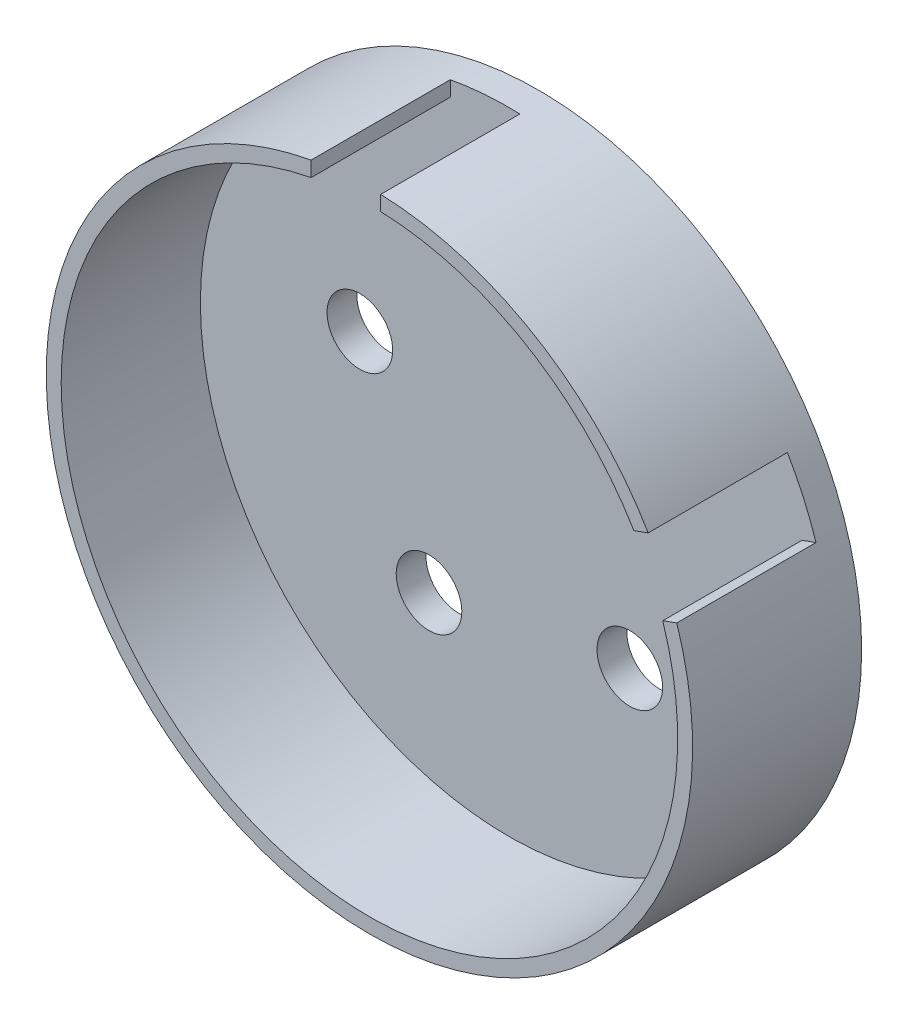
from build123d import *

# Parameters (mm, degrees)
ESQUISSE1_R                  = 32.5
BOSS_EXTRU_1_DEPTH           = 17
ESQUISSE2_R                  = 31
ENL_V_MAT_EXTRU_1_DEPTH      = 14
ESQUISSE3_W                  = 7
ESQUISSE3_H                  = 21.006684507
ENL_V_MAT_EXTRU_2_DEPTH      = 14
R_P_TITION_CIRCULAIRE1_COUNT = 2
R_P_TITION_CIRCULAIRE1_ANGLE = 70
D_GAGEMENT_M61_D             = 6.6
R_P_TITION_CIRCULAIRE2_COUNT = 3
R_P_TITION_CIRCULAIRE2_ANGLE = 160


with BuildPart() as part:
    # Esquisse1 → Boss.-Extru.1 (new body)
    with BuildSketch(Plane.XY):
        Circle(ESQUISSE1_R)
    extrude(amount=BOSS_EXTRU_1_DEPTH)

    # Esquisse2 → Enlèv. mat.-Extru.1 (cut)
    with BuildSketch(Plane.XY.offset(17)):
        Circle(ESQUISSE2_R)
    extrude(amount=-ENL_V_MAT_EXTRU_1_DEPTH, mode=Mode.SUBTRACT)

    # Esquisse3 → Enlèv. mat.-Extru.2 (cut)
    with BuildSketch(Plane.XY.offset(17)):
        with Locations((-2.367072337, 31.778784947)):
            Rectangle(ESQUISSE3_W, ESQUISSE3_H)
    enl_v_mat_extru_2 = extrude(amount=-ENL_V_MAT_EXTRU_2_DEPTH, mode=Mode.SUBTRACT)

    # Répétition circulaire1: Enlèv. mat.-Extru.2 ×2 about axis
    r_p_tition_circulaire1_axis = Axis((0, 0, 17), (0, 0, -1))
    for i in range(1, R_P_TITION_CIRCULAIRE1_COUNT):
        add(enl_v_mat_extru_2.rotate(r_p_tition_circulaire1_axis, i * R_P_TITION_CIRCULAIRE1_ANGLE / (R_P_TITION_CIRCULAIRE1_COUNT - 1)), mode=Mode.SUBTRACT)

    # Dégagement M61 (through all)
    with Locations(Plane.XY.offset(3)):
        with Locations((-14.965006824, 5.494015269)):
            d_gagement_m61 = Hole(D_GAGEMENT_M61_D / 2)

    # Répétition circulaire2: Dégagement M61 ×3 about axis
    r_p_tition_circulaire2_axis = Axis((0, 0, 0), (0, 0, 1))
    for i in range(1, R_P_TITION_CIRCULAIRE2_COUNT):
        add(d_gagement_m61.rotate(r_p_tition_circulaire2_axis, i * R_P_TITION_CIRCULAIRE2_ANGLE / (R_P_TITION_CIRCULAIRE2_COUNT - 1)), mode=Mode.SUBTRACT)


solid = part.part
